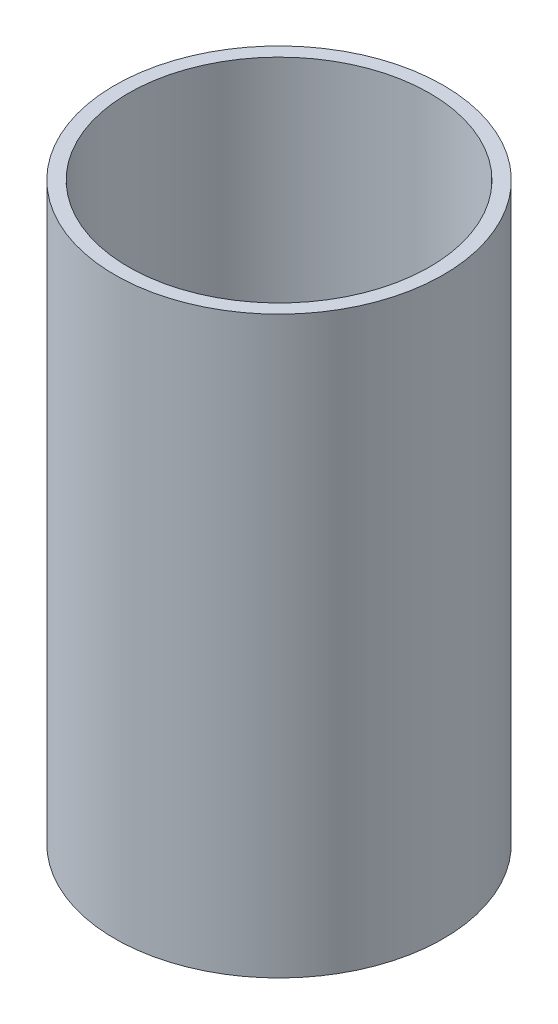
from build123d import *

# Parameters (mm, degrees)
SKETCH1_R           = 12
SKETCH1_R_2         = 11
BOSS_EXTRUDE1_DEPTH = 21


with BuildPart() as part:
    # Sketch1 → Boss-Extrude1 (new, symmetric)
    with BuildSketch(Plane(origin=(0, 0, 0), x_dir=(-1, 0, 0), z_dir=(0, 1, 0))):
        with Locations(Location((0, 0, 0), (0, 0, 270))):
            Circle(SKETCH1_R)
        with Locations(Location((0, 0, 0), (0, 0, 270))):
            Circle(SKETCH1_R_2, mode=Mode.SUBTRACT)
    extrude(amount=BOSS_EXTRUDE1_DEPTH, both=True)


solid = part.part
